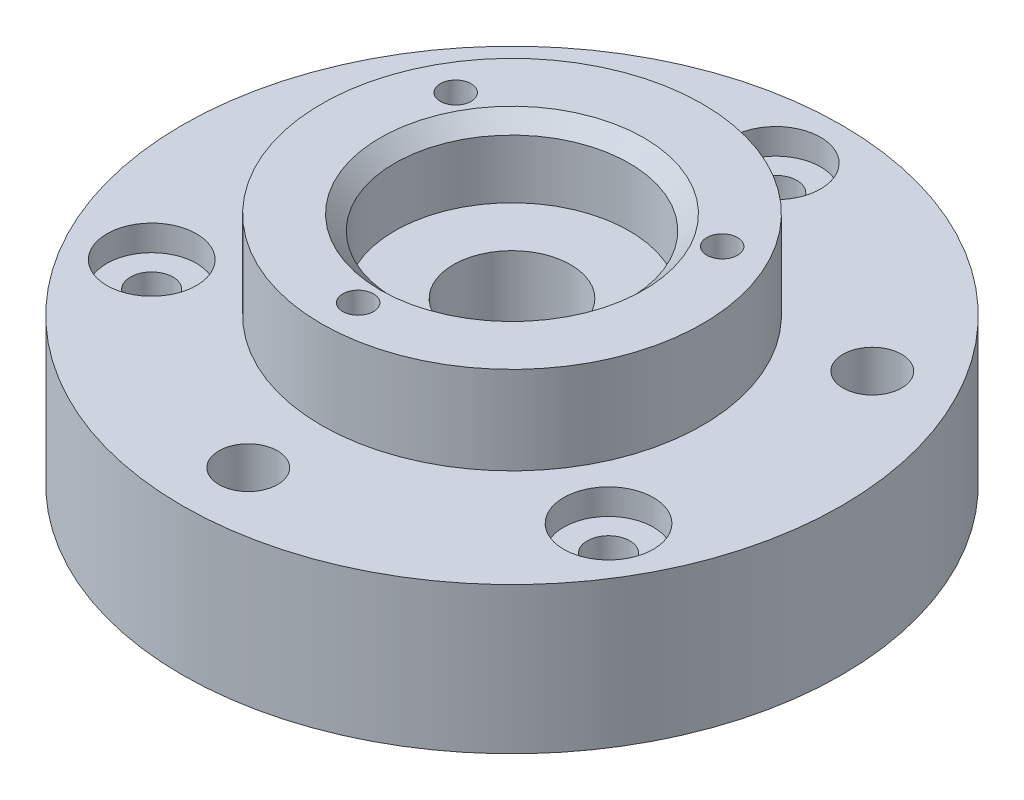
from build123d import *

# Parameters (mm, degrees)
HOLE1_D                                 = 35
HOLE1_DEPTH                             = 5
FILLET1_R                               = 2
CBORE_FOR_M5_HEX_HEAD_BOLT1_D           = 5.8
CBORE_FOR_M5_HEX_HEAD_BOLT1_CBORE_D     = 12.238
CBORE_FOR_M5_HEX_HEAD_BOLT1_CBORE_DEPTH = 3.5
F_8_0MM_DOWEL_HOLE1_D                   = 8
HOLE2_D                                 = 16
HOLE2_CBORE_D                           = 32
HOLE2_CBORE_DEPTH                       = 10
CHAMFER1_SIZE                           = 2
CIRPATTERN4_COUNT                       = 3
F_10_0_10_DIAMETER_HOLE1_D              = 10
F_10_0_10_DIAMETER_HOLE1_DEPTH          = 32
F_10_0_10_DIAMETER_HOLE1_TIP            = 3.004303095
F_10_0_10_DIAMETER_HOLE2_REACH          = 75.614
F_10_0_10_DIAMETER_HOLE2_BORE_R         = 5


with BuildPart() as part:
    # Sketch5 → Revolve4 (revolve)
    with BuildSketch(Plane.XY, mode=Mode.PRIVATE) as revolve4_sk:
        Polygon((0, 0), (27.5, 0), (27.5, 5), (45, 5), (45, 25), (26, 25), (26, 37), (0, 37), align=None)
    revolve(revolve4_sk.sketch.rotate(Axis((0, 0, 0), (0, 1, 0)), 90), axis=Axis((0, 0, 0), (0, 1, 0)))

    # Hole1
    with Locations(Plane(origin=(0, 0, 0), x_dir=(-1, 0, 0), z_dir=(0, -1, 0))):
        with Locations((0, 0)):
            Hole(HOLE1_D / 2, depth=HOLE1_DEPTH)

    # Fillet1
    fillet1_edges = [part.edges().sort_by_distance(p)[0] for p in [
        (-17.5, 5, 0),
    ]]
    fillet(fillet1_edges, radius=FILLET1_R)

    # CBORE for M5 Hex Head Bolt1 (through all)
    with Locations(Plane(origin=(0, 25, 0), x_dir=(1, 0, 0), z_dir=(0, 1, 0))):
        with Locations((0, 36)):
            cbore_for_m5_hex_head_bolt1 = CounterBoreHole(CBORE_FOR_M5_HEX_HEAD_BOLT1_D / 2, CBORE_FOR_M5_HEX_HEAD_BOLT1_CBORE_D / 2, CBORE_FOR_M5_HEX_HEAD_BOLT1_CBORE_DEPTH)

    # Ø8.0mm Dowel Hole1 (through all)
    with Locations(Plane(origin=(0, 25, 0), x_dir=(1, 0, 0), z_dir=(0, 1, 0))):
        with Locations((0, -36)):
            f_8_0mm_dowel_hole1 = Hole(F_8_0MM_DOWEL_HOLE1_D / 2)

    # Hole2 (through all)
    with Locations(Plane(origin=(0, 37, 0), x_dir=(1, 0, 0), z_dir=(0, 1, 0))):
        with Locations((0, 0)):
            CounterBoreHole(HOLE2_D / 2, HOLE2_CBORE_D / 2, HOLE2_CBORE_DEPTH)

    # Chamfer1
    chamfer1_edges = [part.edges().sort_by_distance(p)[0] for p in [
        (-16, 37, 0),
    ]]
    chamfer(chamfer1_edges, length=CHAMFER1_SIZE)

    # Sketch22 → M5 Tapped Hole1 (revolve, cut)
    with BuildSketch(Plane(origin=(0, 37, 21), x_dir=(0, 0, 1), z_dir=(1, 0, 0))):
        Polygon((0, 0), (0, 14.2618073), (2.1, 13), (2.1, 0), align=None)
    m5_tapped_hole1 = revolve(axis=Axis((0, 43.35, 21), (0, -1, 0)), mode=Mode.SUBTRACT)

    # CirPattern4: CBORE for M5 Hex Head Bolt1, Ø8.0mm Dowel Hole1, M5 Tapped Hole1 ×3 about axis
    cirpattern4_axis = Axis((0, 0, 0), (0, 1, 0))
    add([cbore_for_m5_hex_head_bolt1.rotate(cirpattern4_axis, i * 360 / CIRPATTERN4_COUNT) for i in range(1, CIRPATTERN4_COUNT)], mode=Mode.SUBTRACT)
    add([f_8_0mm_dowel_hole1.rotate(cirpattern4_axis, i * 360 / CIRPATTERN4_COUNT) for i in range(1, CIRPATTERN4_COUNT)], mode=Mode.SUBTRACT)
    add([m5_tapped_hole1.rotate(cirpattern4_axis, i * 360 / CIRPATTERN4_COUNT) for i in range(1, CIRPATTERN4_COUNT)], mode=Mode.SUBTRACT)

    # Ø10.0 (10) Diameter Hole1
    with Locations(Plane.ZY.offset(45)):
        with Locations((0, 15)):
            Hole(F_10_0_10_DIAMETER_HOLE1_D / 2, depth=F_10_0_10_DIAMETER_HOLE1_DEPTH)
            with Locations((0, 0, -(F_10_0_10_DIAMETER_HOLE1_DEPTH + F_10_0_10_DIAMETER_HOLE1_TIP / 2))):  # 118° drill point
                Cone(0, F_10_0_10_DIAMETER_HOLE1_D / 2, F_10_0_10_DIAMETER_HOLE1_TIP, mode=Mode.SUBTRACT)

    # Ø10.0 (10) Diameter Hole2 bore → Ø10.0 (10) Diameter Hole2 (cut, up to next)
    with BuildSketch(Plane.XZ, mode=Mode.PRIVATE) as f_10_0_10_diameter_hole2_sk1:
        with Locations((-18, 0)):
            Circle(F_10_0_10_DIAMETER_HOLE2_BORE_R)
    f_10_0_10_diameter_hole2_tool1 = extrude(f_10_0_10_diameter_hole2_sk1.sketch, amount=-F_10_0_10_DIAMETER_HOLE2_REACH, mode=Mode.PRIVATE) & part.part
    add(f_10_0_10_diameter_hole2_tool1.solids().sort_by_distance((-18, 0, 0))[0], mode=Mode.SUBTRACT)


solid = part.part
